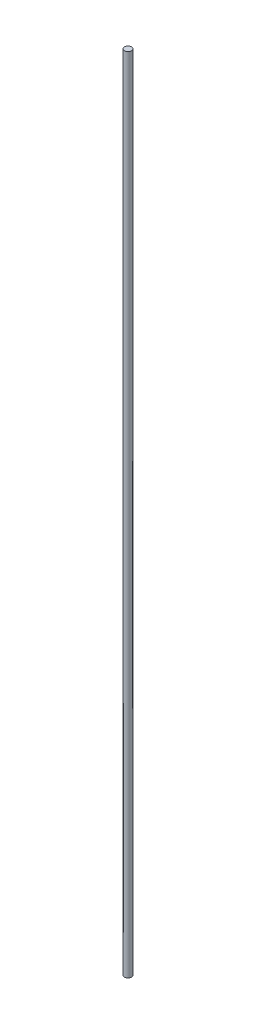
from build123d import *

# Parameters (mm, degrees)
SKETCH1_W = 0.75
SKETCH1_H = 174


with BuildPart() as part:
    # Sketch1 → Varilla_carbono (revolve)
    with BuildSketch(Plane.XY, mode=Mode.PRIVATE) as varilla_carbono_sk:
        with Locations((0.375, -88)):
            Rectangle(SKETCH1_W, SKETCH1_H)
    revolve(varilla_carbono_sk.sketch.rotate(Axis((0, -179, 0), (0, 1, 0)), 90), axis=Axis((0, -179, 0), (0, 1, 0)))


solid = part.part
